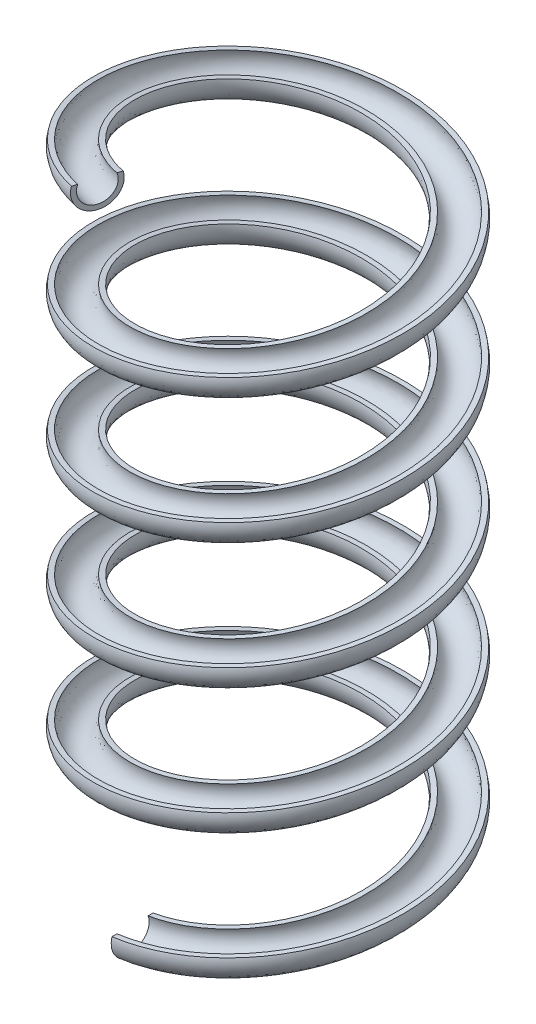
from build123d import *

# Parameters (mm, degrees)
SWEEP2_PITCH  = 159.070707071
SWEEP2_HEIGHT = 787.4
SWEEP2_RADIUS = 171.45


with BuildPart() as part:
    # Sweep2: sweep along a helix
    with BuildLine() as sweep2_path:
        Helix(SWEEP2_PITCH, SWEEP2_HEIGHT, SWEEP2_RADIUS, center=(0, 0, 0), direction=(0, 1, 0))
    # Sketch6 → Sweep2 (sweep)
    with BuildSketch(Plane(origin=(0, 0, 0), x_dir=(0, 0, -1), z_dir=(1, 0, 0))):
        with BuildLine():
            Line((-151.765, 7.184204897), (-145.415, 7.184204897))
            ThreePointArc((-145.415, 7.184204897), (-171.45, -27.008036304), (-197.485, 7.184204897))
            Line((-197.485, 7.184204897), (-191.135, 7.184204897))
            ThreePointArc((-191.135, 7.184204897), (-171.45, -20.955), (-151.765, 7.184204897))
        make_face()
    sweep(path=sweep2_path.line, is_frenet=True)


solid = part.part
